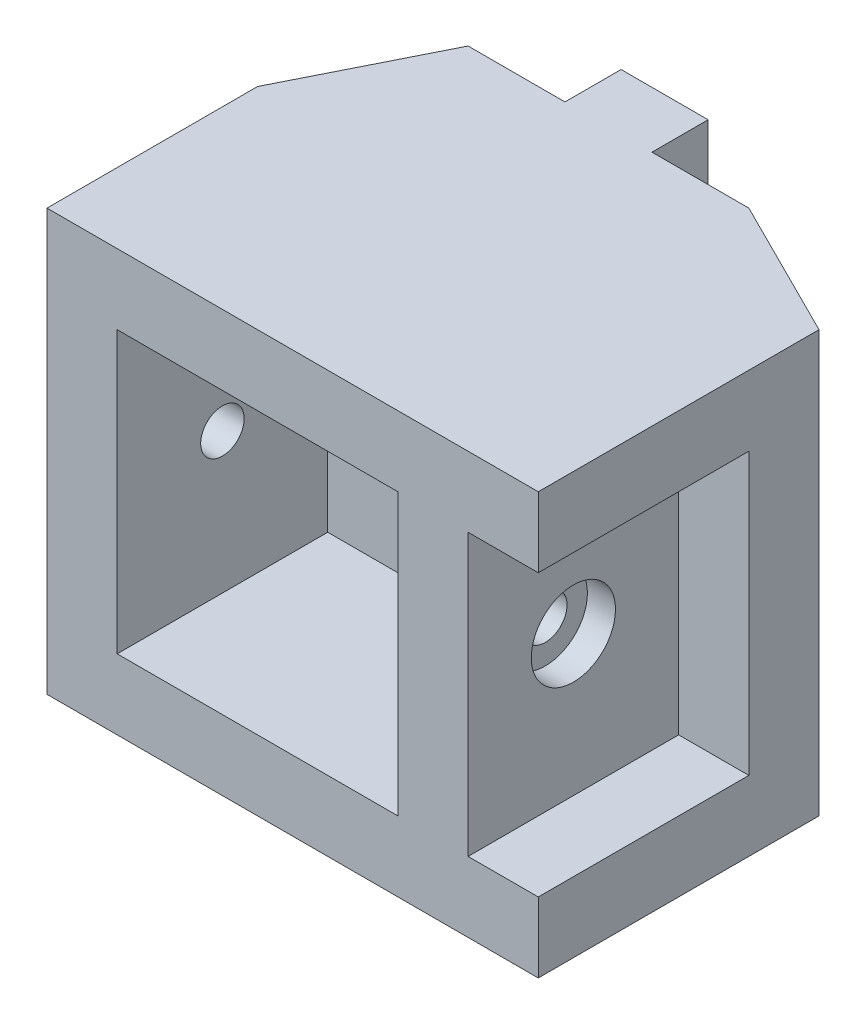
from build123d import *

# Parameters (mm, degrees)
EXTRUDE_1_DEPTH      = 14
CUT_EXTRUDE_1_DEPTH  = 44
SKETCH_3_W           = 6.2
SKETCH_3_H           = 6.2
CUT_EXTRUDE_2_DEPTH  = 4
SKETCH_4_R           = 4
CUT_EXTRUDE_3_DEPTH  = 5
SKETCH_5_R           = 2.6
CUT_EXTRUDE_4_DEPTH  = 5
EXTRUDE_2_DEPTH      = 44
SKETCH_8_W           = 5
SKETCH_8_H           = 5
EXTRUDE_4_DEPTH      = 15
SKETCH_9_W           = 35
SKETCH_9_H           = 5
EXTRUDE_5_DEPTH      = 7
CUT_EXTRUDE_6_DEPTH  = 10
CUT_EXTRUDE_START    = -30
SKETCH_14_R          = 1.55
CUT_EXTRUDE_7_DEPTH  = 30
SKETCH_15_R          = 3
CUT_EXTRUDE_8_DEPTH  = 2
CUT_EXTRUDE_START_2  = -2
SKETCH_16_R          = 3
CUT_EXTRUDE_9_DEPTH  = 2
SKETCH_17_W          = 35
SKETCH_17_H          = 7
CUT_EXTRUDE_10_DEPTH = 10
SKETCH_18_W          = 35
SKETCH_18_H          = 7
CUT_EXTRUDE_11_DEPTH = 20


with BuildPart() as part:
    # 草图1 → 凸台-拉伸1 (new body)
    with BuildSketch(Plane.XY):
        Polygon((-15, 22), (-15, -22), (15, -22), (15, 22), (0, 22), align=None)
    extrude(amount=EXTRUDE_1_DEPTH)

    # 草图2 → 切除-拉伸1 (cut)
    with BuildSketch(Plane(origin=(0, 22, 0), x_dir=(1, 0, 0), z_dir=(0, 1, 0))):
        Polygon((-15, 0), (-15, -14), (-10, -4), (-3.1, -4), (-3.1, 0), align=None)
        Polygon((3.1, -4), (10, -4), (15, -14), (15, 0), (3.1, 0), align=None)
    extrude(amount=-CUT_EXTRUDE_1_DEPTH, mode=Mode.SUBTRACT)

    # 草图3 → 切除-拉伸2 (cut)
    with BuildSketch(Plane(origin=(0, 0, 0), x_dir=(-1, 0, 0), z_dir=(0, 0, -1))):
        Rectangle(SKETCH_3_W, SKETCH_3_H)
    extrude(amount=-CUT_EXTRUDE_2_DEPTH, mode=Mode.SUBTRACT)

    # 草图4 → 切除-拉伸3 (cut)
    with BuildSketch(Plane.XY.offset(14)):
        Circle(SKETCH_4_R)
    extrude(amount=-CUT_EXTRUDE_3_DEPTH, mode=Mode.SUBTRACT)

    # 草图5 → 切除-拉伸4 (cut)
    with BuildSketch(Plane.XY.offset(9)):
        Circle(SKETCH_5_R)
    extrude(amount=-CUT_EXTRUDE_4_DEPTH, mode=Mode.SUBTRACT)

    # 草图7 → 凸台-拉伸2 (add)
    with BuildSketch(Plane.XZ.offset(22)):
        Polygon((15, 14), (20, 14), (20, 9), (10, 4), (10, 14), align=None)
    extrude(amount=-EXTRUDE_2_DEPTH)

    # 草图8 → 凸台-拉伸4 (add)
    with BuildSketch(Plane.XY.offset(14)):
        with Locations((-12.5, -12.5)):
            Rectangle(SKETCH_8_W, SKETCH_8_H)
        Polygon((-10, -10), (-10, -15), (10, -15), (10, -10), (0, -10), align=None)
        Polygon((-10, 0), (-10, 10), (-15, 10), (-15, -10), (-10, -10), align=None)
        with Locations((-12.5, 12.5)):
            Rectangle(SKETCH_8_W, SKETCH_8_H)
        Polygon((-10, 15), (10, 15), (10, 10), (0, 10), (-10, 10), align=None)
        with Locations((12.5, 12.5)):
            Rectangle(SKETCH_8_W, SKETCH_8_H)
        Polygon((15, 10), (15, -10), (10, -10), (10, 0), (10, 10), align=None)
        with Locations((12.5, -12.5)):
            Rectangle(SKETCH_8_W, SKETCH_8_H)
        with Locations((17.5, -12.5)):
            Rectangle(SKETCH_8_W, SKETCH_8_H)
        with Locations((17.5, 12.5)):
            Rectangle(SKETCH_8_W, SKETCH_8_H)
    extrude(amount=EXTRUDE_4_DEPTH)

    # 草图9 → 凸台-拉伸5 (add)
    with BuildSketch(Plane(origin=(0, 15, 0), x_dir=(1, 0, 0), z_dir=(0, 1, 0))):
        with Locations((2.5, -26.5)):
            Rectangle(SKETCH_9_W, SKETCH_9_H)
    extrude(amount=EXTRUDE_5_DEPTH)

    # 草图13 → 切除-拉伸6 (cut)
    with BuildSketch(Plane(origin=(-10, 0, 0), x_dir=(0, 0, -1), z_dir=(1, 0, 0))):
        with BuildLine():
            ThreePointArc((-19.95, 0), (-20.806818927, 1.386362146), (-22.43, 1.24))
            Line((-22.43, 1.24), (-20.57, -1.24))
            ThreePointArc((-20.57, -1.24), (-20.113637854, -0.693181073), (-19.95, 0))
        make_face()
        with BuildLine():
            Line((-20.57, -1.24), (-22.43, 1.24))
            ThreePointArc((-22.43, 1.24), (-22.74, -0.93), (-20.57, -1.24))
        make_face()
    extrude(amount=-CUT_EXTRUDE_6_DEPTH, mode=Mode.SUBTRACT)

    # 草图14 → 切除-拉伸7 (cut)
    with BuildSketch(Plane.ZY.offset(15).offset(CUT_EXTRUDE_START)):
        with Locations(Location((21.5, 0, 0), (0, 0, 180))):
            Circle(SKETCH_14_R)
    extrude(amount=CUT_EXTRUDE_7_DEPTH, mode=Mode.SUBTRACT)

    # 草图15 → 切除-拉伸8 (cut)
    with BuildSketch(Plane(origin=(15, 0, 0), x_dir=(0, 0, -1), z_dir=(1, 0, 0))):
        with Locations((-21.5, 0)):
            Circle(SKETCH_15_R)
    extrude(amount=-CUT_EXTRUDE_8_DEPTH, mode=Mode.SUBTRACT)

    # 草图16 → 切除-拉伸9 (cut)
    with BuildSketch(Plane.ZY.offset(15).offset(CUT_EXTRUDE_START_2)):
        with Locations(Location((21.5, 0, 0), (0, 0, 180))):
            Circle(SKETCH_16_R)
    extrude(amount=CUT_EXTRUDE_9_DEPTH, mode=Mode.SUBTRACT)

    # 草图17 → 切除-拉伸10 (cut)
    with BuildSketch(Plane.XY.offset(29)):
        with Locations((2.5, 18.5)):
            Rectangle(SKETCH_17_W, SKETCH_17_H)
    extrude(amount=-CUT_EXTRUDE_10_DEPTH, mode=Mode.SUBTRACT)

    # 草图18 → 切除-拉伸11 (cut)
    with BuildSketch(Plane.XY.offset(14)):
        with Locations((2.5, 18.5)):
            Rectangle(SKETCH_18_W, SKETCH_18_H)
        with Locations((2.5, -18.5)):
            Rectangle(SKETCH_18_W, SKETCH_18_H)
    extrude(amount=-CUT_EXTRUDE_11_DEPTH, mode=Mode.SUBTRACT)


solid = part.part
